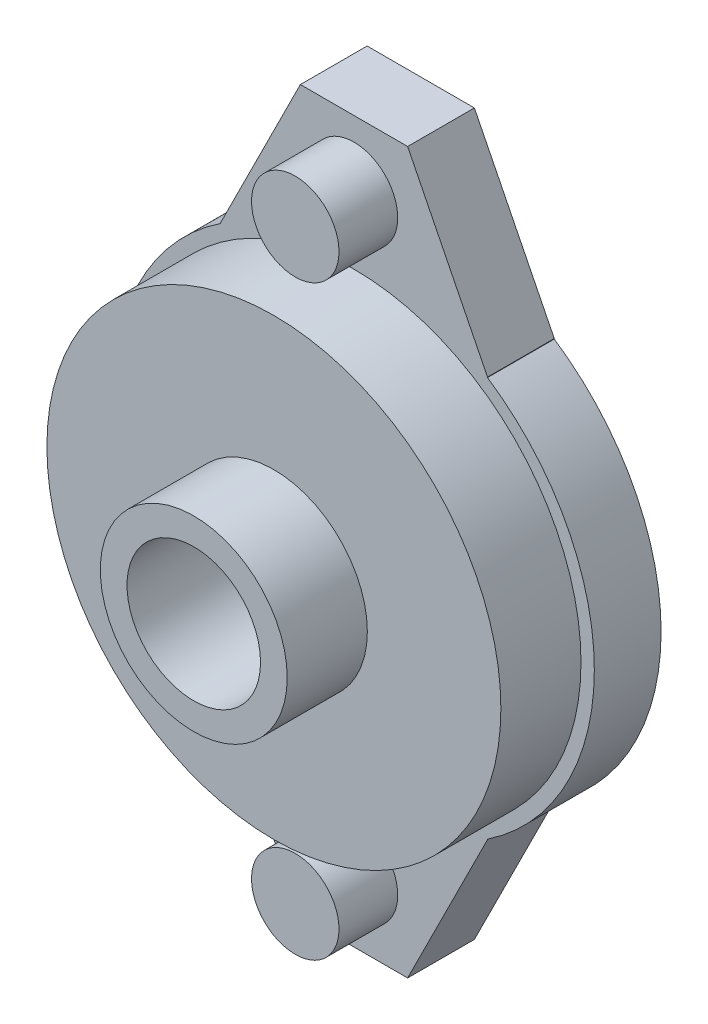
from build123d import *

# Parameters (mm, degrees)
SKETCH_1_R          = 17
EXTRUDE_1_DEPTH     = 6
SKETCH_2_R          = 7
EXTRUDE_2_DEPTH     = 6
SKETCH_3_R          = 18
EXTRUDE_3_DEPTH     = 5
EXTRUDE_START       = -5
EXTRUDE_6_DEPTH     = 5
CUT_EXTRUDE_1_DEPTH = 8
SKETCH_6_R          = 3.275
EXTRUDE_5_DEPTH     = 4.4
SKETCH_9_R          = 5
CUT_EXTRUDE_3_DEPTH = 37.608729958
SKETCH_10_R         = 13.6
SKETCH_10_R_2       = 8.6
CUT_EXTRUDE_4_DEPTH = 3


with BuildPart() as part:
    # 스케치1 → 보스-돌출1 (new body)
    with BuildSketch(Plane.XY):
        Circle(SKETCH_1_R)
    extrude(amount=EXTRUDE_1_DEPTH)

    # 스케치2 → 보스-돌출2 (add)
    with BuildSketch(Plane.XY.offset(6)):
        Circle(SKETCH_2_R)
    extrude(amount=EXTRUDE_2_DEPTH)

    # 스케치3 → 보스-돌출3 (add)
    with BuildSketch(Plane(origin=(0, 0, 0), x_dir=(-1, 0, 0), z_dir=(0, 0, -1))):
        Circle(SKETCH_3_R)
    extrude(amount=EXTRUDE_3_DEPTH)

    # 스케치8 → 보스-돌출6 (add)
    with BuildSketch(Plane(origin=(0, 0, -5), x_dir=(-1, 0, 0), z_dir=(0, 0, -1)).offset(EXTRUDE_START)):
        with BuildLine():
            Line((-10, 14.966629547), (-10, 26.966629547))
            Line((-10, 26.966629547), (10, 26.966629547))
            Line((10, 26.966629547), (10, 14.966629547))
            ThreePointArc((10, 14.966629547), (0, 18), (-10, 14.966629547))
        make_face()
    extrude_6 = extrude(amount=EXTRUDE_6_DEPTH)

    # 스케치5 → 컷-돌출1 (cut)
    with BuildSketch(Plane.XY):
        Polygon((-10, 27), (-10, 15), (-4, 27), align=None)
        Polygon((4, 27), (10, 27), (10, 15), align=None)
    cut_extrude_1 = extrude(amount=-CUT_EXTRUDE_1_DEPTH, mode=Mode.SUBTRACT)

    # 스케치6 → 보스-돌출5 (add)
    with BuildSketch(Plane.XY):
        with Locations(Location((0, 21.966629547, 0), (0, 0, 180))):
            Circle(SKETCH_6_R)
    extrude_5 = extrude(amount=EXTRUDE_5_DEPTH)

    # 대칭 복사6: 보스-돌출6, 컷-돌출1, 보스-돌출5 across plane
    add(extrude_6.mirror(Plane.ZX))
    add(cut_extrude_1.mirror(Plane.ZX), mode=Mode.SUBTRACT)
    add(extrude_5.mirror(Plane.ZX))

    # 스케치9 → 컷-돌출3 (cut, through all)
    with BuildSketch(Plane.XY.offset(12)):
        Circle(SKETCH_9_R)
    extrude(amount=-CUT_EXTRUDE_3_DEPTH, mode=Mode.SUBTRACT)

    # 스케치10 → 컷-돌출4 (cut)
    with BuildSketch(Plane(origin=(0, 0, -5), x_dir=(-1, 0, 0), z_dir=(0, 0, -1))):
        Circle(SKETCH_10_R)
        Circle(SKETCH_10_R_2, mode=Mode.SUBTRACT)
    extrude(amount=-CUT_EXTRUDE_4_DEPTH, mode=Mode.SUBTRACT)


solid = part.part
